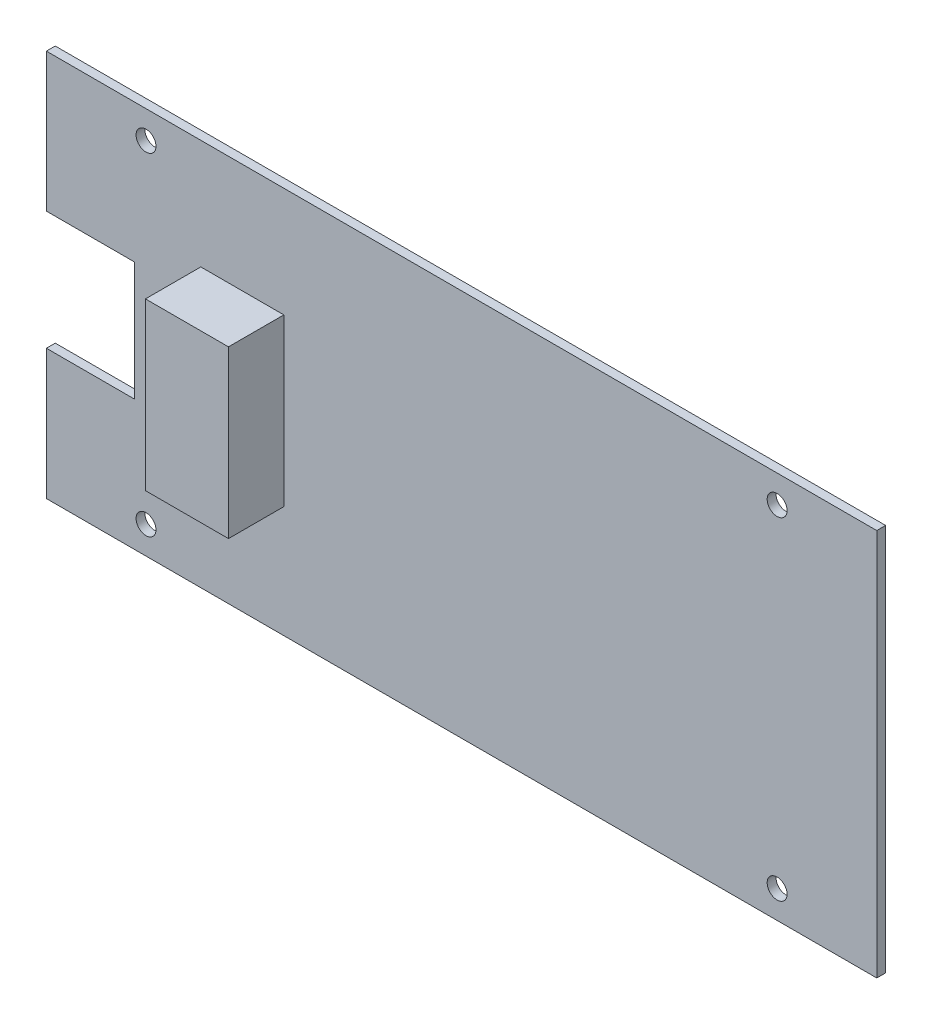
from build123d import *

# Parameters (mm, degrees)
SKETCH_1_W          = 150
SKETCH_1_H          = 70
EXTRUDE_1_DEPTH     = 1.6
HOLE_WIZARD_M3_1_D  = 3.6
SKETCH_5_W          = 35.774901566
SKETCH_5_H          = 21.448543783
CUT_EXTRUDE_1_DEPTH = 10
SKETCH_6_W          = 15
SKETCH_6_H          = 30
EXTRUDE_2_DEPTH     = 10


with BuildPart() as part:
    # ｽｹｯﾁ1 → ﾎﾞｽ - 押し出し1 (new body)
    with BuildSketch(Plane.XY):
        Rectangle(SKETCH_1_W, SKETCH_1_H)
    extrude(amount=EXTRUDE_1_DEPTH)

    # M3 すきま穴1 (through all)
    with Locations(Plane.XY.offset(1.6)):
        with Locations((57, 30), (57, -30), (-57, -30), (-57, 30)):
            Hole(HOLE_WIZARD_M3_1_D / 2)

    # ｽｹｯﾁ5 → ｶｯﾄ - 押し出し1 (cut)
    with BuildSketch(Plane.XY.offset(1.6)):
        with Locations((-77.011061726, -0.754700365)):
            Rectangle(SKETCH_5_W, SKETCH_5_H)
    extrude(amount=-CUT_EXTRUDE_1_DEPTH, mode=Mode.SUBTRACT)

    # ｽｹｯﾁ6 → ﾎﾞｽ - 押し出し2 (add)
    with BuildSketch(Plane.XY.offset(1.6)):
        with Locations((-39.605094466, 0.185984115)):
            Rectangle(SKETCH_6_W, SKETCH_6_H)
    extrude(amount=EXTRUDE_2_DEPTH)


solid = part.part
